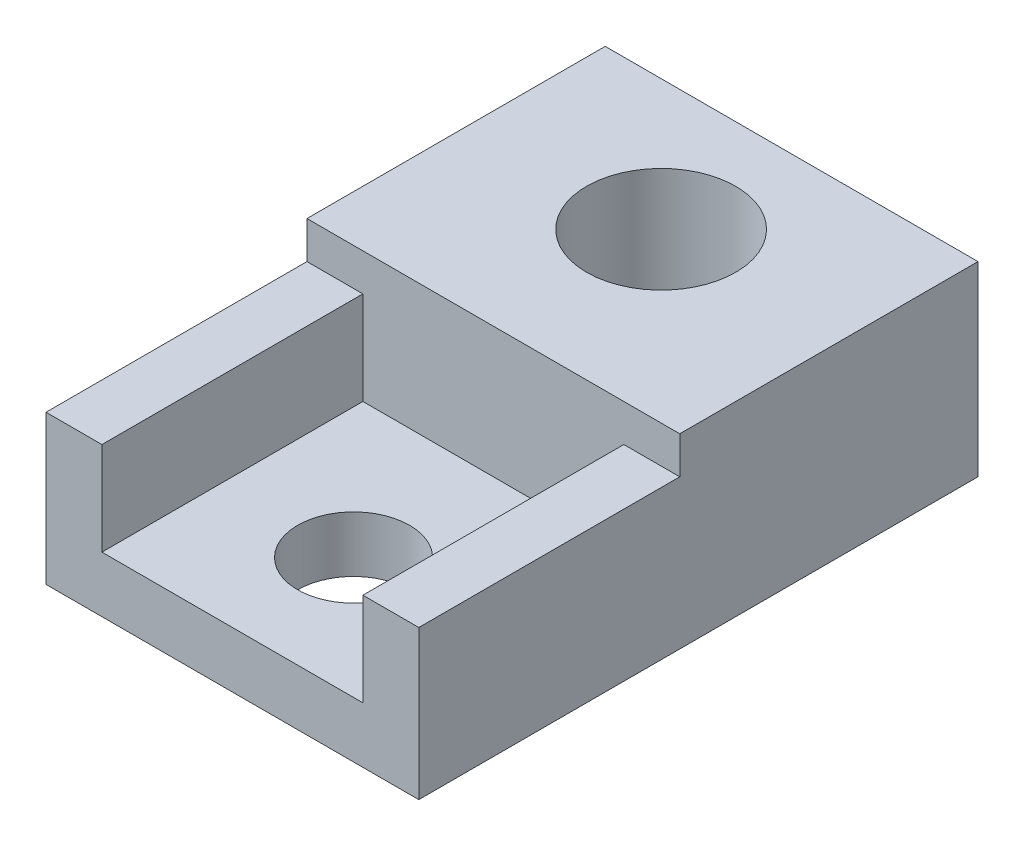
from build123d import *

# Parameters (mm, degrees)
SKETCH1_W               = 20
SKETCH1_H               = 30
BOSS_EXTRUDE1_DEPTH     = 3
SKETCH2_W               = 5
SKETCH2_H               = 12
BOSS_EXTRUDE2_DEPTH     = 3
SKETCH3_R               = 7
SKETCH3_R_2             = 4
BOSS_EXTRUDE3_DEPTH     = 7
SKETCH4_R               = 4
BOSS_EXTRUDE4_DEPTH     = 1
CUT_EXTRUDE1_DEPTH      = 20.339079606
CUT_EXTRUDE1_DEPTH_BACK = 20.339079606
SKETCH5_R               = 3
SKETCH6_R               = 7
SKETCH6_R_2             = 4
BOSS_EXTRUDE6_DEPTH     = 7
SKETCH7_W               = 20
SKETCH7_H               = 3
BOSS_EXTRUDE7_DEPTH     = 19
SKETCH8_W               = 5
SKETCH8_H               = 3
BOSS_EXTRUDE8_DEPTH     = 12
CUT_EXTRUDE2_START      = -1.5
SKETCH10_R              = 4
CUT_EXTRUDE2_DEPTH      = 1.5
SKETCH12_W              = 3
SKETCH12_H              = 32
BOSS_EXTRUDE9_DEPTH     = 5
CUT_EXTRUDE3_DEPTH      = 52
CUT_EXTRUDE3_DEPTH_BACK = 52
SKETCH13_W              = 44.018077629
SKETCH13_H              = 41.98282258
CUT_EXTRUDE4_DEPTH      = 2


with BuildPart() as part:
    # Sketch1 → Boss-Extrude1 (new body)
    with BuildSketch(Plane(origin=(0, 0, 0), x_dir=(1, 0, 0), z_dir=(0, 1, 0))):
        Rectangle(SKETCH1_W, SKETCH1_H)
    boss_extrude1 = extrude(amount=BOSS_EXTRUDE1_DEPTH)

    # Sketch2 → Boss-Extrude2 (add)
    with BuildSketch(Plane.XZ):
        with Locations((0, -9)):
            Rectangle(SKETCH2_W, SKETCH2_H)
    boss_extrude2 = extrude(amount=BOSS_EXTRUDE2_DEPTH)

    # Sketch3 → Boss-Extrude3 (add)
    with BuildSketch(Plane(origin=(0, 3, 0), x_dir=(1, 0, 0), z_dir=(0, 1, 0))):
        with Locations(Location((0, 8, 0), (0, 0, 90))):
            Circle(SKETCH3_R)
        with Locations(Location((0, 8, 0), (0, 0, 270))):
            Circle(SKETCH3_R_2, mode=Mode.SUBTRACT)
    boss_extrude3 = extrude(amount=BOSS_EXTRUDE3_DEPTH)

    # Sketch4 → Boss-Extrude4 (add)
    with BuildSketch(Plane(origin=(0, 3, 0), x_dir=(1, 0, 0), z_dir=(0, 1, 0))):
        with Locations(Location((0, 8, 0), (0, 0, 270))):
            Circle(SKETCH4_R)
    boss_extrude4 = extrude(amount=BOSS_EXTRUDE4_DEPTH)

    # Sketch5 → Cut-Extrude1 (cut, two sides: drawn at the far end of the back side and taken through both)
    with BuildSketch(Plane(origin=(0, 3, 0), x_dir=(1, 0, 0), z_dir=(0, 1, 0)).offset(-CUT_EXTRUDE1_DEPTH_BACK)):
        with Locations(Location((0, -8.5, 0), (0, 0, 90))):
            Circle(SKETCH5_R)
    extrude(amount=CUT_EXTRUDE1_DEPTH + CUT_EXTRUDE1_DEPTH_BACK, mode=Mode.SUBTRACT)

    # Sketch6 → Boss-Extrude6 (add)
    # profile 1 of 2: a face of its own
    with BuildSketch(Plane(origin=(0, 3, 0), x_dir=(1, 0, 0), z_dir=(0, 1, 0))):
        Polygon((0, 15), (-10, 15), (-10, -1), (10, -1), (10, 15), align=None)
        with BuildLine():
            ThreePointArc((7, 8), (-4.949747468, 3.050252532), (0, 15))
            ThreePointArc((0, 15), (4.949747468, 12.949747468), (7, 8))
        make_face(mode=Mode.SUBTRACT)
    # profile 2 of 2: a face of its own
    with BuildSketch(Plane(origin=(0, 3, 0), x_dir=(1, 0, 0), z_dir=(0, 1, 0))):
        with Locations((0, 8)):
            Circle(SKETCH6_R)
        with Locations(Location((0, 8, 0), (0, 0, 270))):
            Circle(SKETCH6_R_2, mode=Mode.SUBTRACT)
    boss_extrude6 = extrude(amount=BOSS_EXTRUDE6_DEPTH)

    # Sketch7 → Boss-Extrude7 (add)
    with BuildSketch(Plane.XY.offset(15)):
        with Locations((0, 1.5)):
            Rectangle(SKETCH7_W, SKETCH7_H)
    extrude(amount=BOSS_EXTRUDE7_DEPTH)

    # Mirror3: Boss-Extrude1, Boss-Extrude2, Boss-Extrude3, Boss-Extrude4, Boss-Extrude6 across plane
    add(boss_extrude1.mirror(Plane.XY.offset(17)))
    add(boss_extrude2.mirror(Plane.XY.offset(17)))
    add(boss_extrude3.mirror(Plane.XY.offset(17)))
    add(boss_extrude4.mirror(Plane.XY.offset(17)))
    add(boss_extrude6.mirror(Plane.XY.offset(17)))

    # Sketch8 → Boss-Extrude8 (add)
    with BuildSketch(Plane(origin=(0, 0, 37), x_dir=(-1, 0, 0), z_dir=(0, 0, -1))):
        with Locations((0, -1.5)):
            Rectangle(SKETCH8_W, SKETCH8_H)
    extrude(amount=BOSS_EXTRUDE8_DEPTH)

    # Sketch10 → Cut-Extrude2 (cut)
    with BuildSketch(Plane(origin=(0, 4, 0), x_dir=(1, 0, 0), z_dir=(0, 1, 0)).offset(CUT_EXTRUDE2_START)):
        with Locations(Location((0, 8, 0), (0, 0, 270))):
            Circle(SKETCH10_R)
        with Locations(Location((0, -42, 0), (0, 0, 90))):
            Circle(SKETCH10_R)
    extrude(amount=CUT_EXTRUDE2_DEPTH, mode=Mode.SUBTRACT)

    # Sketch12 → Boss-Extrude9 (add)
    with BuildSketch(Plane(origin=(0, 3, 0), x_dir=(1, 0, 0), z_dir=(0, 1, 0))):
        with Locations((8.5, -17)):
            Rectangle(SKETCH12_W, SKETCH12_H)
        with Locations((-8.5, -17)):
            Rectangle(SKETCH12_W, SKETCH12_H)
    extrude(amount=BOSS_EXTRUDE9_DEPTH)

    # Sketch13 → Cut-Extrude3 (cut, two sides: drawn at the far end of the back side and taken through both)
    with BuildSketch(Plane(origin=(0, 0, 0), x_dir=(1, 0, 0), z_dir=(0, 1, 0)).offset(-CUT_EXTRUDE3_DEPTH_BACK)):
        with Locations((-0.328555997, -37.99141129)):
            Rectangle(SKETCH13_W, SKETCH13_H)
    extrude(amount=CUT_EXTRUDE3_DEPTH + CUT_EXTRUDE3_DEPTH_BACK, mode=Mode.SUBTRACT)

    # Sketch14 → Cut-Extrude4 (cut)
    with BuildSketch(Plane.XY.offset(17)):
        Polygon((10, 8), (7, 8), (7, 3), (-7, 3), (-7, 8), (-10, 8), (-10, 0), (10, 0), align=None)
    extrude(amount=-CUT_EXTRUDE4_DEPTH, mode=Mode.SUBTRACT)


solid = part.part
